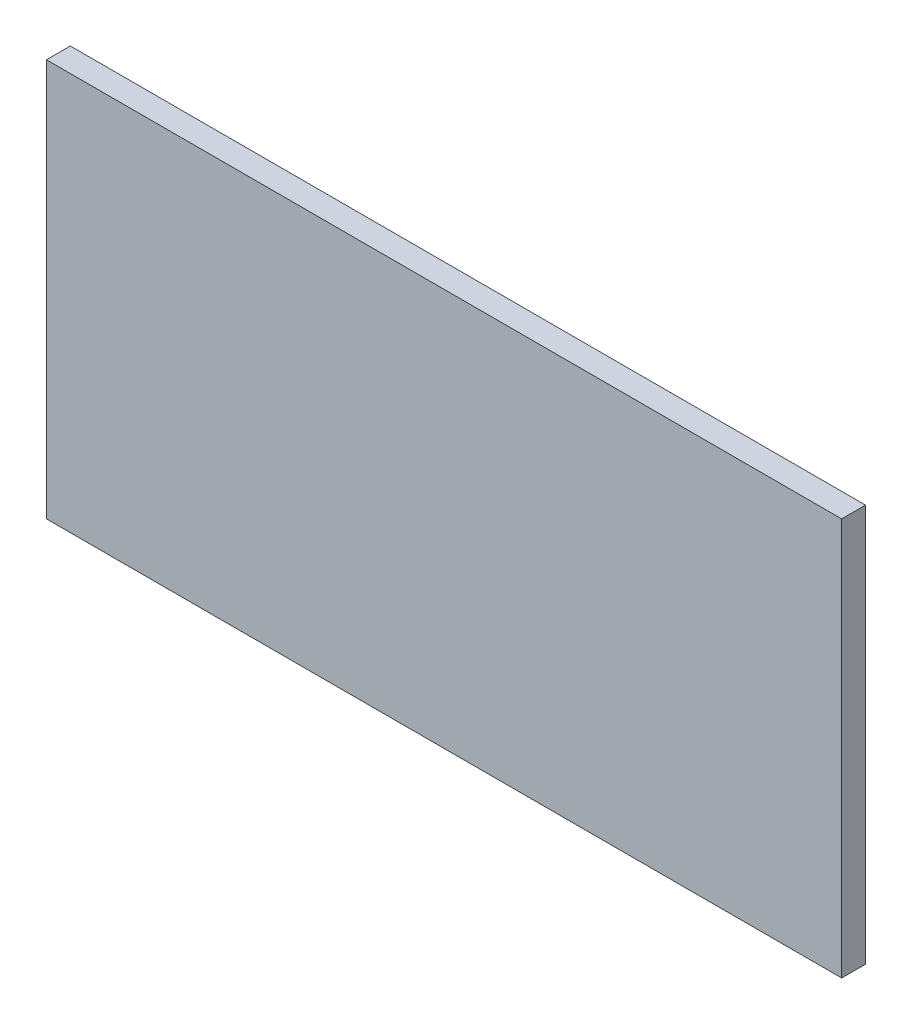
from build123d import *

# Parameters (mm, degrees)
ESBO_O2_W                = 200
ESBO_O2_H                = 100
RESSALTO_EXTRUS_O1_DEPTH = 6


with BuildPart() as part:
    # Esboço2 → Ressalto-extrusão1 (new body)
    with BuildSketch(Plane.XY):
        with Locations((100, 50)):
            Rectangle(ESBO_O2_W, ESBO_O2_H)
    extrude(amount=RESSALTO_EXTRUS_O1_DEPTH)


solid = part.part
